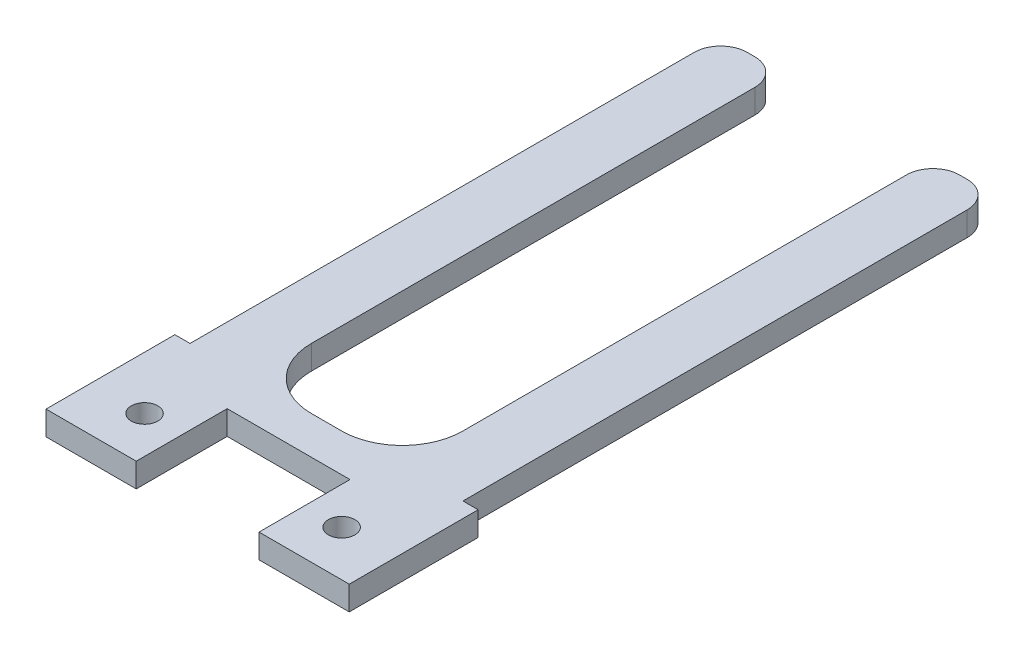
from build123d import *

# Parameters (mm, degrees)
CROQUIS1_R              = 1.75
SALIENTE_EXTRUIR1_DEPTH = 1.5875
REDONDEO1_R             = 8


with BuildPart() as part:
    # Croquis1 → Saliente-Extruir1 (new, symmetric)
    with BuildSketch(Plane(origin=(0, 0, 0), x_dir=(1, 0, 0), z_dir=(0, 1, 0))):
        with BuildLine():
            Line((8.1, 0), (-8.1, 0))
            Line((-8.1, 0), (-8.1, -12))
            Line((-8.1, -12), (-20, -12))
            Line((-20, -12), (-20, 5))
            Line((-20, 5), (-18, 5))
            Line((-18, 5), (-18, 71.5))
            ThreePointArc((-18, 71.5), (-16.974873734, 73.974873734), (-14.5, 75))
            Line((-14.5, 75), (-13.5, 75))
            ThreePointArc((-13.5, 75), (-11.025126266, 73.974873734), (-10, 71.5))
            Line((-10, 71.5), (-10, 5))
            Line((-10, 5), (10, 5))
            Line((10, 5), (10, 71.5))
            ThreePointArc((10, 71.5), (11.025126266, 73.974873734), (13.5, 75))
            Line((13.5, 75), (14.5, 75))
            ThreePointArc((14.5, 75), (16.974873734, 73.974873734), (18, 71.5))
            Line((18, 71.5), (18, 5))
            Line((18, 5), (20, 5))
            Line((20, 5), (20, -12))
            Line((20, -12), (8.1, -12))
            Line((8.1, -12), (8.1, 0))
        make_face()
        with Locations(Location((-13, -6, 0), (0, 0, 270))):
            Circle(CROQUIS1_R, mode=Mode.SUBTRACT)
        with Locations(Location((13, -6, 0), (0, 0, 270))):
            Circle(CROQUIS1_R, mode=Mode.SUBTRACT)
    extrude(amount=SALIENTE_EXTRUIR1_DEPTH, both=True)

    # Redondeo1
    redondeo1_edges = [part.edges().sort_by_distance(p)[0] for p in [
        (-10, 0, -5),
        (10, 0, -5),
    ]]
    fillet(redondeo1_edges, radius=REDONDEO1_R)


solid = part.part
